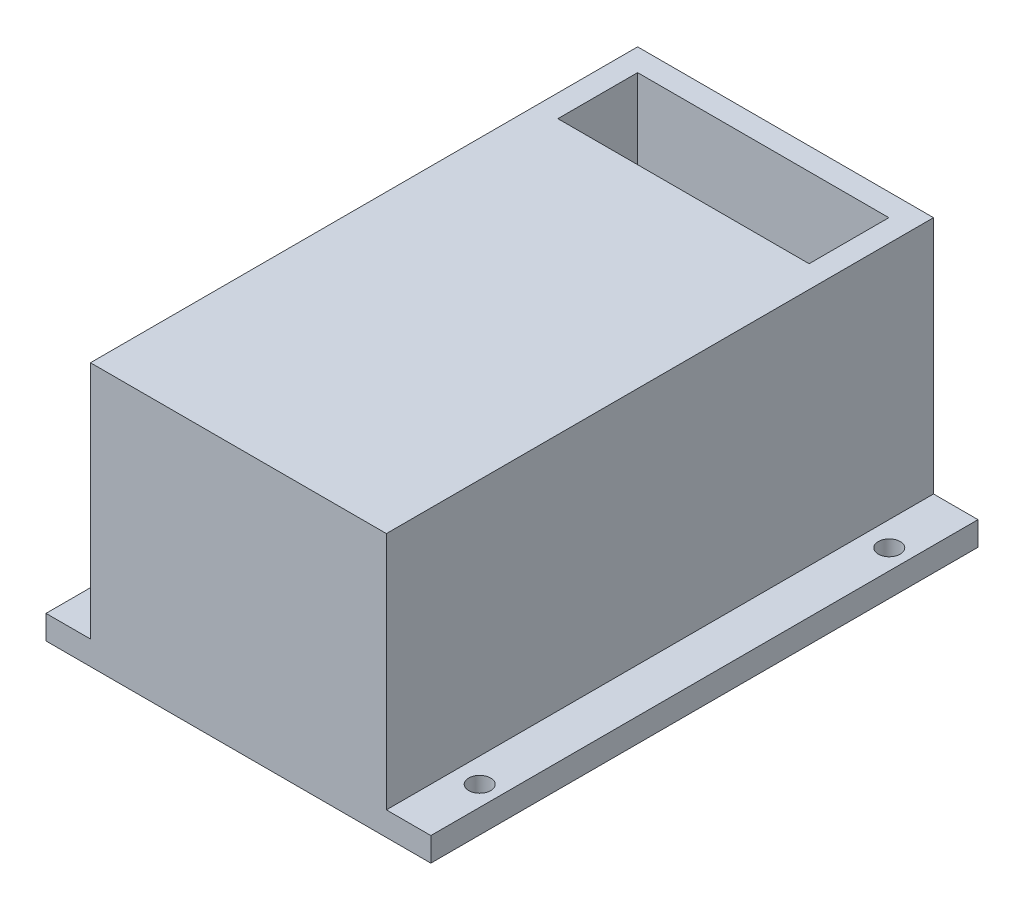
from build123d import *

# Parameters (mm, degrees)
SKETCH2_W           = 37.1
SKETCH2_H           = 68.6
BOSS_EXTRUDE1_DEPTH = 33
SKETCH1_W           = 31.5
SKETCH1_H           = 63
CUT_EXTRUDE1_DEPTH  = 30
SKETCH3_W           = 31.5
SKETCH3_H           = 10
CUT_EXTRUDE2_DEPTH  = 5
SKETCH6_W           = 5.575
SKETCH6_H           = 68.6
SKETCH6_R           = 1.375
BOSS_EXTRUDE2_DEPTH = 3


with BuildPart() as part:
    # Sketch2 → Boss-Extrude1 (new body)
    with BuildSketch(Plane(origin=(0, 0, 0), x_dir=(1, 0, 0), z_dir=(0, 1, 0))):
        with Locations((15.75, 31.5)):
            Rectangle(SKETCH2_W, SKETCH2_H)
    extrude(amount=BOSS_EXTRUDE1_DEPTH)

    # Sketch1 → Cut-Extrude1 (cut)
    with BuildSketch(Plane(origin=(0, 0, 0), x_dir=(1, 0, 0), z_dir=(0, 1, 0))):
        with Locations((15.75, 31.5)):
            Rectangle(SKETCH1_W, SKETCH1_H)
    extrude(amount=CUT_EXTRUDE1_DEPTH, mode=Mode.SUBTRACT)

    # Sketch3 → Cut-Extrude2 (cut)
    with BuildSketch(Plane.XZ.offset(-30)):
        with Locations((15.75, -58)):
            Rectangle(SKETCH3_W, SKETCH3_H)
    extrude(amount=-CUT_EXTRUDE2_DEPTH, mode=Mode.SUBTRACT)

    # Sketch6 → Boss-Extrude2 (add)
    # profile 1 of 2: a face of its own
    with BuildSketch(Plane.XZ):
        with Locations((37.0875, -31.5)):
            Rectangle(SKETCH6_W, SKETCH6_H)
        with Locations(Location((37.375, -57.175, 0), (0, 0, 270))):
            Circle(SKETCH6_R, mode=Mode.SUBTRACT)
        with Locations(Location((37.375, -5.825, 0), (0, 0, 90))):
            Circle(SKETCH6_R, mode=Mode.SUBTRACT)
    # profile 2 of 2: a face of its own
    with BuildSketch(Plane.XZ):
        with Locations((-5.5875, -31.5)):
            Rectangle(SKETCH6_W, SKETCH6_H)
        with Locations(Location((-5.875, -5.825, 0), (0, 0, 270))):
            Circle(SKETCH6_R, mode=Mode.SUBTRACT)
        with Locations(Location((-5.875, -57.175, 0), (0, 0, 90))):
            Circle(SKETCH6_R, mode=Mode.SUBTRACT)
    extrude(amount=-BOSS_EXTRUDE2_DEPTH)


solid = part.part
